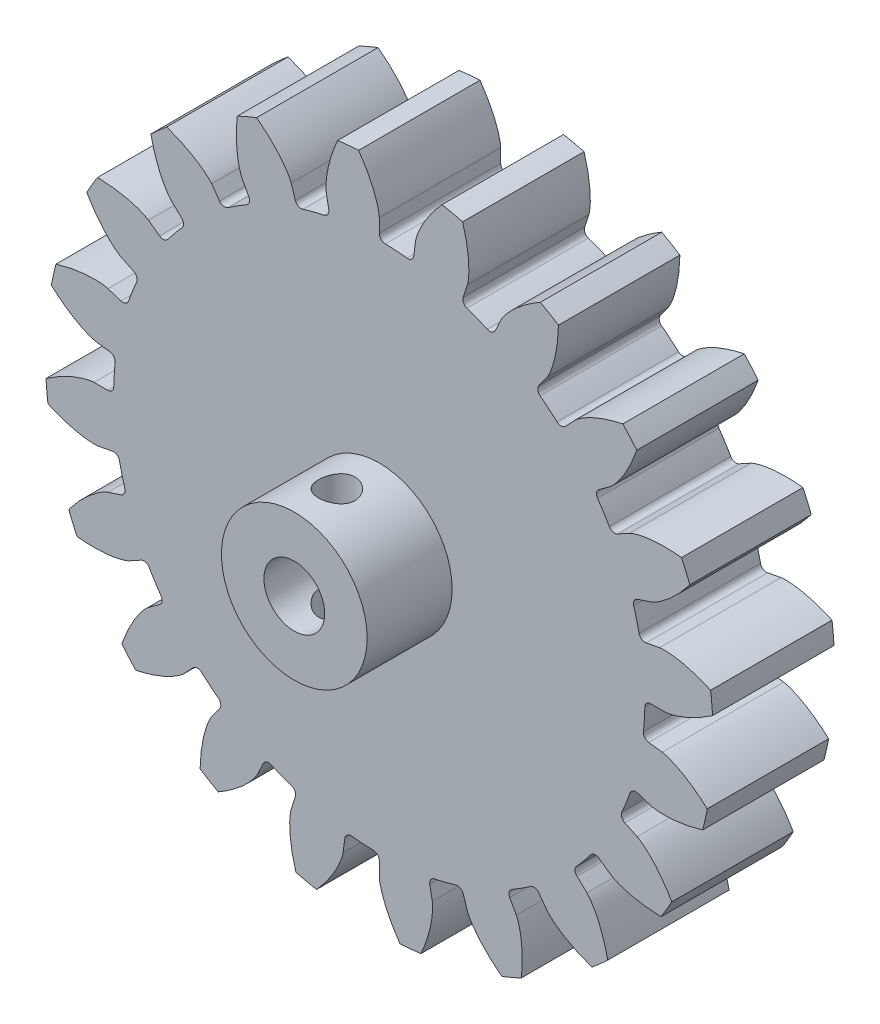
from build123d import *

# Parameters (mm, degrees)
SKETCH1_R           = 27.5
BOSS_EXTRUDE1_DEPTH = 10
CUT_EXTRUDE1_DEPTH  = 41.155946011
CIRPATTERN6_COUNT   = 20
SKETCH3_R           = 2.5
CUT_EXTRUDE2_DEPTH  = 10
BOSS_EXTRUDE2_START = 7
SKETCH4_R           = 6
SKETCH4_R_2         = 2.5
BOSS_EXTRUDE2_DEPTH = 7
SKETCH5_R           = 1.5
CUT_EXTRUDE3_DEPTH  = 43.375937035


with BuildPart() as part:
    # Sketch1 → Boss-Extrude1 (new body)
    with BuildSketch(Plane.XY):
        Circle(SKETCH1_R)
    extrude(amount=BOSS_EXTRUDE1_DEPTH)

    # Sketch2 → Cut-Extrude1 (cut, symmetric)
    with BuildSketch(Plane.XY.offset(10)):
        with BuildLine():
            Line((23.49231552, 0), (22.36941271, 0))
            ThreePointArc((22.36941271, 0), (22.019831956, -0.142518118), (21.869537566, -0.488826816))
            ThreePointArc((21.869537566, -0.488826816), (21.830723885, -1.391085782), (21.754702114, -2.290973794))
            ThreePointArc((21.754702114, -2.290973794), (21.859824804, -2.653558043), (22.18848867, -2.839294904))
            Line((22.18848867, -2.839294904), (23.30230943, -2.981822215))
            add(Edge.make_bspline(
                [(23.30230943, -2.981822215), (23.310260749, -2.982956167), (23.332511196, -2.986490812), (23.374367375, -2.994570792), (23.442320766, -3.009732376), (23.528359699, -3.031949065), (23.63887141, -3.063977973), (23.768096607, -3.10595354), (23.90902325, -3.156508958), (24.061085302, -3.216260883), (24.211608727, -3.280051768), (24.36060245, -3.347554552), (24.507936388, -3.418273403), (24.685054198, -3.508016955), (24.895514928, -3.621285348), (25.1385407, -3.761843666), (25.410531044, -3.930837724), (25.683610942, -4.113191596), (25.948855032, -4.300907339), (26.21264073, -4.499956031), (26.464869406, -4.699191067), (26.702507889, -4.898957777), (26.862429549, -5.037478518), (26.966800243, -5.131176062), (27.009633306, -5.170078206)],
                knots=[0, 0, 0, 0, 0, 0.005376749, 0.015083688, 0.02853182, 0.04661014, 0.064854849, 0.092110525, 0.119476176, 0.146842496, 0.174208854, 0.201574956, 0.228941013, 0.256307345, 0.307035032, 0.361767352, 0.416499661, 0.471231937, 0.525964282, 0.580696616, 0.635428982, 0.690161387, 0.728074997, 0.728074997, 0.728074997, 0.728074997, 0.728074997], degree=4))
            ThreePointArc((27.009633306, -5.170078206), (27.377133852, -2.596640529), (27.5, 0))
            ThreePointArc((27.5, 0), (27.486847982, 0.850404607), (27.447404509, 1.699995793))
            add(Edge.make_bspline(
                [(23.49231552, 0), (23.500346458, 0.00011554), (23.522865588, 0.000797402), (23.565408805, 0.003499328), (23.634737011, 0.009913127), (23.72289997, 0.021029415), (23.836583213, 0.038772292), (23.970091091, 0.064006121), (24.116294794, 0.096265172), (24.274711132, 0.136232959), (24.432113944, 0.180402332), (24.588470567, 0.228447743), (24.743589038, 0.279893883), (24.930665246, 0.346430457), (25.153800649, 0.432069467), (25.41270155, 0.540644281), (25.703942036, 0.673748444), (25.997958993, 0.819966071), (26.284884086, 0.972496783), (26.571801047, 1.136453893), (26.847278111, 1.302062744), (27.108350472, 1.470050867), (27.284560783, 1.587152785), (27.399980127, 1.666844985), (27.447404509, 1.699995793)],
                knots=[0, 0, 0, 0, 0, 0.005376749, 0.015083688, 0.02853182, 0.04661014, 0.064854849, 0.092110525, 0.119476176, 0.146842496, 0.174208854, 0.201574956, 0.228941013, 0.256307345, 0.307035032, 0.361767352, 0.416499661, 0.471231937, 0.525964282, 0.580696616, 0.635428982, 0.690161387, 0.728074997, 0.728074997, 0.728074997, 0.728074997, 0.728074997], degree=4))
        make_face()
    cut_extrude1 = extrude(amount=CUT_EXTRUDE1_DEPTH, both=True, mode=Mode.SUBTRACT)

    # CirPattern6: Cut-Extrude1 ×20 about axis
    cirpattern6_axis = Axis((0, 0, 10), (0, 0, -1))
    for i in range(1, CIRPATTERN6_COUNT):
        add(cut_extrude1.rotate(cirpattern6_axis, i * 360 / CIRPATTERN6_COUNT), mode=Mode.SUBTRACT)

    # Sketch3 → Cut-Extrude2 (cut)
    with BuildSketch(Plane.XY.offset(10)):
        Circle(SKETCH3_R)
    extrude(amount=-CUT_EXTRUDE2_DEPTH, mode=Mode.SUBTRACT)

    # Sketch4 → Boss-Extrude2 (add)
    with BuildSketch(Plane.XY.offset(10).offset(BOSS_EXTRUDE2_START)):
        Circle(SKETCH4_R)
        Circle(SKETCH4_R_2, mode=Mode.SUBTRACT)
    boss_extrude2 = extrude(amount=-BOSS_EXTRUDE2_DEPTH)

    # Sketch5 → Cut-Extrude3 (cut, symmetric)
    with BuildSketch(Plane(origin=(0, 0, 0), x_dir=(1, 0, 0), z_dir=(0, 1, 0))):
        with Locations(Location((0, -13.5, 0), (0, 0, 270))):
            Circle(SKETCH5_R)
    cut_extrude3 = extrude(amount=CUT_EXTRUDE3_DEPTH, both=True, mode=Mode.SUBTRACT)

    # Mirror2: Boss-Extrude2, Cut-Extrude3 across plane
    add(boss_extrude2.mirror(Plane.XY.offset(5)))
    add(cut_extrude3.mirror(Plane.XY.offset(5)), mode=Mode.SUBTRACT)


solid = part.part
